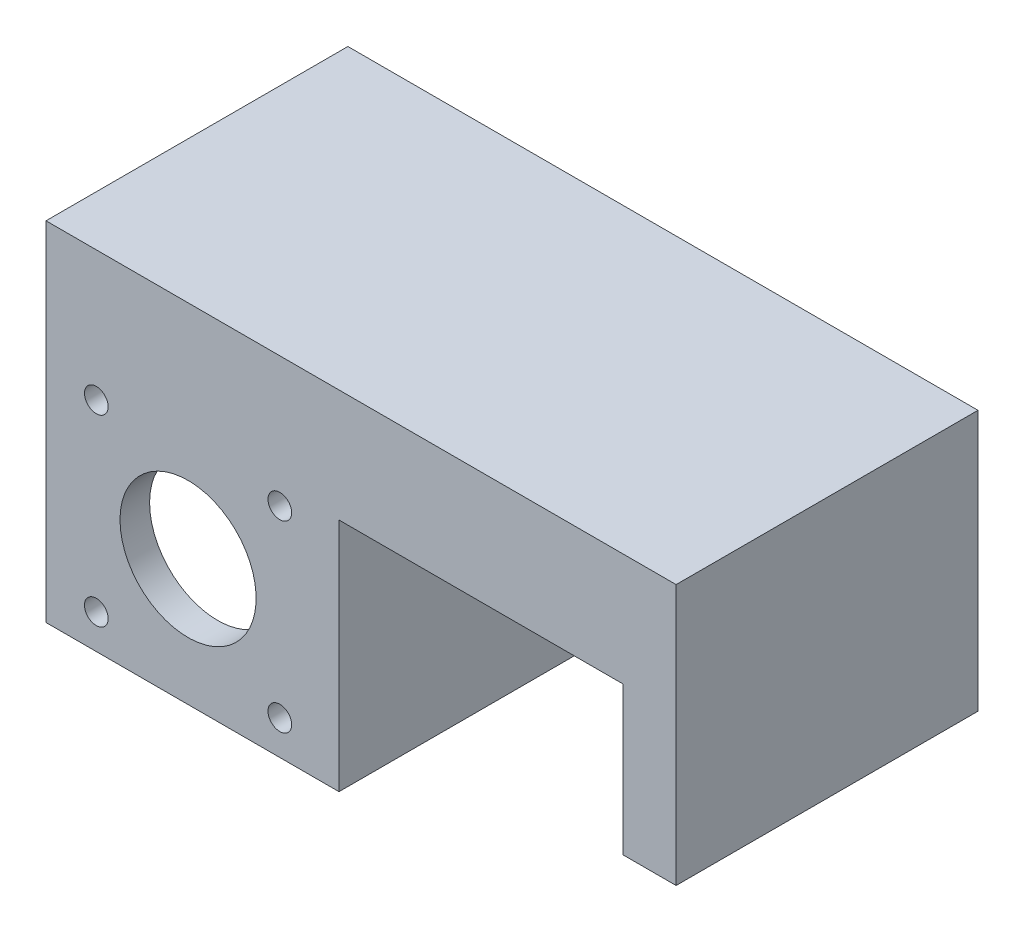
from build123d import *

# Parameters (mm, degrees)
SKETCH1_W            = 48
SKETCH1_H            = 53
BOSS_EXTRUDE1_DEPTH  = 10
SKETCH2_W            = 48
SKETCH2_H            = 5.616325
BOSS_EXTRUDE2_DEPTH  = 33.1917878
SKETCH4_W            = 4
SKETCH4_H            = 10
BOSS_EXTRUDE4_DEPTH  = 40
SKETCH5_W            = 48
SKETCH5_H            = 10.8609375
BOSS_EXTRUDE5_DEPTH  = 23.1917878
SKETCH6_W            = 48
SKETCH6_H            = 5
BOSS_EXTRUDE6_DEPTH  = 42.3
SKETCH7_W            = 12.8082122
SKETCH7_H            = 16.4772625
BOSS_EXTRUDE7_DEPTH  = 48
CUT_EXTRUDE1_REACH   = 84.426
SKETCH8_R            = 11.5
SKETCH8_R_2          = 2
FILLET1_R            = 10
FILLET2_R            = 4
SKETCH9_W            = 5
SKETCH9_H            = 16.4772625
BOSS_EXTRUDE9_DEPTH  = 48
CUT_EXTRUDE2_DEPTH   = 88.252507127
SKETCH11_W           = 51
SKETCH11_H           = 16.4772625
BOSS_EXTRUDE10_DEPTH = 49.45
BOSS_EXTRUDE11_DEPTH = 46
SKETCH16_W           = 47.95
SKETCH16_H           = 51
BOSS_EXTRUDE14_DEPTH = 2.55
SKETCH14_W           = 5
SKETCH14_H           = 42.3
BOSS_EXTRUDE13_DEPTH = 1.5
SKETCH17_W           = 51
SKETCH17_H           = 19.0272625
BOSS_EXTRUDE15_DEPTH = 9
BOSS_EXTRUDE16_DEPTH = 25
SKETCH19_R           = 1.9304
CUT_EXTRUDE3_DEPTH   = 125.404890183


with BuildPart() as part:
    # Sketch1 → Boss-Extrude1 (new body)
    with BuildSketch(Plane.XY):
        with Locations((24, 26.5)):
            Rectangle(SKETCH1_W, SKETCH1_H)
    extrude(amount=BOSS_EXTRUDE1_DEPTH)

    # Sketch2 → Boss-Extrude2 (add)
    with BuildSketch(Plane(origin=(0, 0, 0), x_dir=(-1, 0, 0), z_dir=(0, 0, -1))):
        with Locations((-24, -2.8081625)):
            Rectangle(SKETCH2_W, SKETCH2_H)
    extrude(amount=-BOSS_EXTRUDE2_DEPTH)

    # Sketch4 → Boss-Extrude4 (add)
    with BuildSketch(Plane.XY.offset(10)):
        with Locations((2, 48)):
            Rectangle(SKETCH4_W, SKETCH4_H)
        with Locations((46, 48)):
            Rectangle(SKETCH4_W, SKETCH4_H)
    extrude(amount=BOSS_EXTRUDE4_DEPTH)

    # Sketch5 → Boss-Extrude5 (add)
    with BuildSketch(Plane.XY.offset(10)):
        with Locations((24, 5.43046875)):
            Rectangle(SKETCH5_W, SKETCH5_H)
    extrude(amount=BOSS_EXTRUDE5_DEPTH)

    # Sketch6 → Boss-Extrude6 (add)
    with BuildSketch(Plane.XZ.offset(5.616325)):
        with Locations((24, 30.6917878)):
            Rectangle(SKETCH6_W, SKETCH6_H)
    extrude(amount=BOSS_EXTRUDE6_DEPTH)

    # Sketch7 → Boss-Extrude7 (add)
    with BuildSketch(Plane.ZY):
        with Locations((-6.4041061, 2.62230625)):
            Rectangle(SKETCH7_W, SKETCH7_H)
    extrude(amount=-BOSS_EXTRUDE7_DEPTH)

    # Sketch8 → Cut-Extrude1 (cut, up to next)
    with BuildSketch(Plane(origin=(0, 0, 28.1917878), x_dir=(-1, 0, 0), z_dir=(0, 0, -1)), mode=Mode.PRIVATE) as cut_extrude1_sk1:
        with Locations((-24, -26.616325)):
            Circle(SKETCH8_R)
    cut_extrude1_tool1 = extrude(cut_extrude1_sk1.sketch, amount=-CUT_EXTRUDE1_REACH, mode=Mode.PRIVATE) & part.part
    # Sketch8 → Cut-Extrude1 (cut, up to next)
    with BuildSketch(Plane(origin=(0, 0, 28.1917878), x_dir=(-1, 0, 0), z_dir=(0, 0, -1)), mode=Mode.PRIVATE) as cut_extrude1_sk2:
        with Locations((-39.5, -11.116325)):
            Circle(SKETCH8_R_2)
    cut_extrude1_tool2 = extrude(cut_extrude1_sk2.sketch, amount=-CUT_EXTRUDE1_REACH, mode=Mode.PRIVATE) & part.part
    # Sketch8 → Cut-Extrude1 (cut, up to next)
    with BuildSketch(Plane(origin=(0, 0, 28.1917878), x_dir=(-1, 0, 0), z_dir=(0, 0, -1)), mode=Mode.PRIVATE) as cut_extrude1_sk3:
        with Locations((-39.5, -42.116325)):
            Circle(SKETCH8_R_2)
    cut_extrude1_tool3 = extrude(cut_extrude1_sk3.sketch, amount=-CUT_EXTRUDE1_REACH, mode=Mode.PRIVATE) & part.part
    # Sketch8 → Cut-Extrude1 (cut, up to next)
    with BuildSketch(Plane(origin=(0, 0, 28.1917878), x_dir=(-1, 0, 0), z_dir=(0, 0, -1)), mode=Mode.PRIVATE) as cut_extrude1_sk4:
        with Locations((-8.5, -11.116325)):
            Circle(SKETCH8_R_2)
    cut_extrude1_tool4 = extrude(cut_extrude1_sk4.sketch, amount=-CUT_EXTRUDE1_REACH, mode=Mode.PRIVATE) & part.part
    # Sketch8 → Cut-Extrude1 (cut, up to next)
    with BuildSketch(Plane(origin=(0, 0, 28.1917878), x_dir=(-1, 0, 0), z_dir=(0, 0, -1)), mode=Mode.PRIVATE) as cut_extrude1_sk5:
        with Locations((-8.5, -42.116325)):
            Circle(SKETCH8_R_2)
    cut_extrude1_tool5 = extrude(cut_extrude1_sk5.sketch, amount=-CUT_EXTRUDE1_REACH, mode=Mode.PRIVATE) & part.part
    add(cut_extrude1_tool1.solids().sort_by_distance((24, -26.616325, 28.191788))[0], mode=Mode.SUBTRACT)
    add(cut_extrude1_tool2.solids().sort_by_distance((39.5, -11.116325, 28.191788))[0], mode=Mode.SUBTRACT)
    add(cut_extrude1_tool3.solids().sort_by_distance((39.5, -42.116325, 28.191788))[0], mode=Mode.SUBTRACT)
    add(cut_extrude1_tool4.solids().sort_by_distance((8.5, -11.116325, 28.191788))[0], mode=Mode.SUBTRACT)
    add(cut_extrude1_tool5.solids().sort_by_distance((8.5, -42.116325, 28.191788))[0], mode=Mode.SUBTRACT)

    # Fillet1
    fillet1_edges = [part.edges().sort_by_distance(p)[0] for p in [
        (24, 10.8609375, 0),
    ]]
    fillet(fillet1_edges, radius=FILLET1_R)

    # Fillet2
    fillet2_edges = [part.edges().sort_by_distance(p)[0] for p in [
        (2, 43, 10),
        (46, 43, 10),
    ]]
    fillet(fillet2_edges, radius=FILLET2_R)

    # Sketch9 → Boss-Extrude9 (add)
    with BuildSketch(Plane(origin=(48, 0, 0), x_dir=(0, 0, -1), z_dir=(1, 0, 0))):
        with Locations((15.3082122, 2.62230625)):
            Rectangle(SKETCH9_W, SKETCH9_H)
    extrude(amount=-BOSS_EXTRUDE9_DEPTH)

    # Sketch10 → Cut-Extrude2 (cut, through all)
    with BuildSketch(Plane(origin=(48, 0, 0), x_dir=(0, 0, -1), z_dir=(1, 0, 0))):
        Polygon((17.8082122, 10.8609375), (-33.1917878, 10.8609375), (-76.887145623, 43.902095521), (-50.794096938, 74.436514195), (27.207463492, 71.105486703), align=None)
    extrude(amount=-CUT_EXTRUDE2_DEPTH, mode=Mode.SUBTRACT)

    # Sketch11 → Boss-Extrude10 (add)
    with BuildSketch(Plane(origin=(48, 0, 0), x_dir=(0, 0, -1), z_dir=(1, 0, 0))):
        with Locations((-7.6917878, 2.62230625)):
            Rectangle(SKETCH11_W, SKETCH11_H)
    extrude(amount=BOSS_EXTRUDE10_DEPTH)

    # Sketch12 → Boss-Extrude11 (add)
    with BuildSketch(Plane(origin=(0, 0, 28.1917878), x_dir=(-1, 0, 0), z_dir=(0, 0, -1))):
        Polygon((-48, -47.916325), (-45, -47.916325), (-45, -5.616325), (-49.5, -5.616325), (-49.5, -47.916325), align=None)
    extrude(amount=BOSS_EXTRUDE11_DEPTH)

    # Sketch16 → Boss-Extrude14 (add)
    with BuildSketch(Plane.XZ.offset(5.616325)):
        with Locations((73.475, 7.6917878)):
            Rectangle(SKETCH16_W, SKETCH16_H)
    extrude(amount=BOSS_EXTRUDE14_DEPTH)

    # Sketch14 → Boss-Extrude13 (add)
    with BuildSketch(Plane(origin=(49.5, 0, 0), x_dir=(0, 0, -1), z_dir=(1, 0, 0))):
        with Locations((-30.6917878, -26.766325)):
            Rectangle(SKETCH14_W, SKETCH14_H)
    extrude(amount=-BOSS_EXTRUDE13_DEPTH)

    # Sketch17 → Boss-Extrude15 (add)
    with BuildSketch(Plane(origin=(97.45, 0, 0), x_dir=(0, 0, -1), z_dir=(1, 0, 0))):
        with Locations((-7.6917878, 1.34730625)):
            Rectangle(SKETCH17_W, SKETCH17_H)
    extrude(amount=BOSS_EXTRUDE15_DEPTH)

    # Sketch18 → Boss-Extrude16 (add)
    with BuildSketch(Plane.XZ.offset(8.166325)):
        Polygon((49.5, -17.8082122), (106.45, -17.8082122), (106.45, -9.8082122), (106.45, 33.1917878), (97.45, 33.1917878), (97.45, -9.8082122), (49.5, -9.8082122), align=None)
    extrude(amount=BOSS_EXTRUDE16_DEPTH)

    # Sketch19 → Cut-Extrude3 (cut, through all)
    with BuildSketch(Plane.XY.offset(-9.8082122)):
        with Locations((58.475, -26.166325)):
            Circle(SKETCH19_R)
        with Locations((88.475, -26.166325)):
            Circle(SKETCH19_R)
    extrude(amount=-CUT_EXTRUDE3_DEPTH, mode=Mode.SUBTRACT)


solid = part.part
